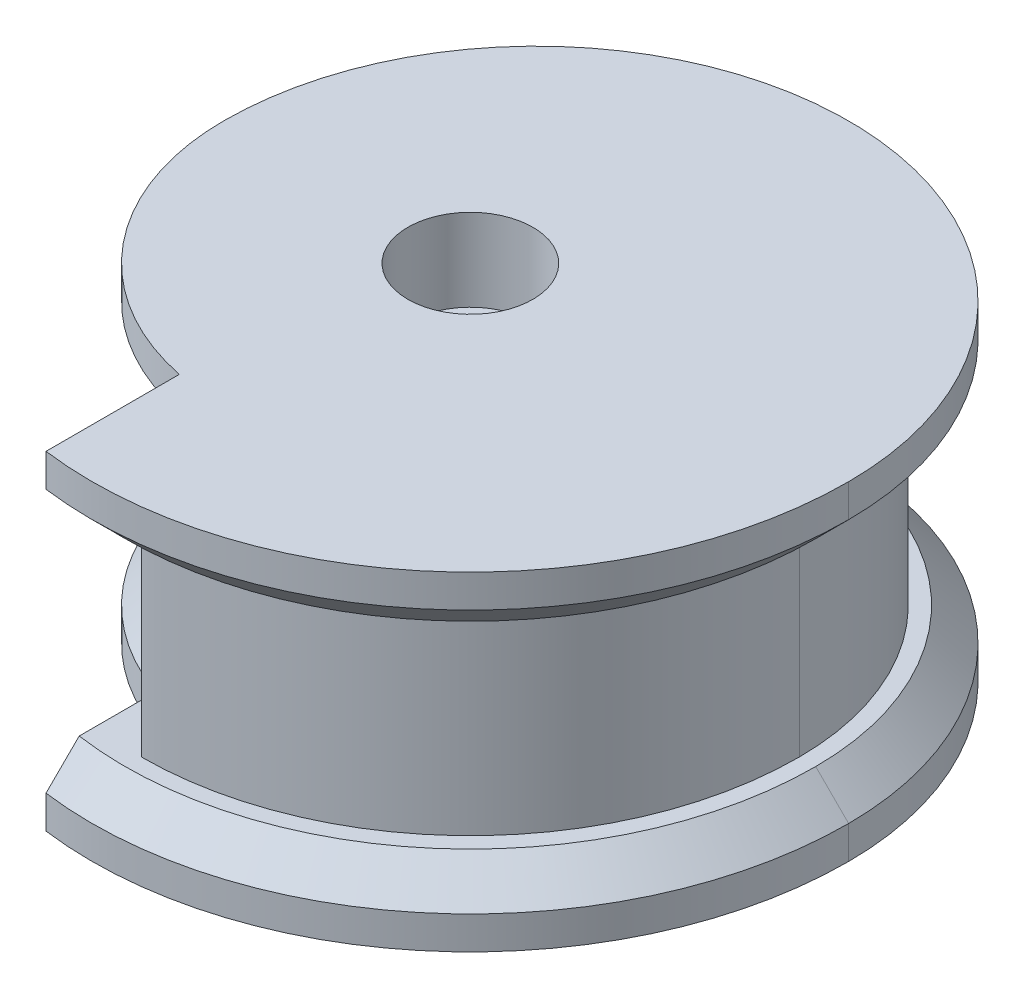
from build123d import *

# Parameters (mm, degrees)
SKETCH1_R           = 6
BOSS_EXTRUDE1_DEPTH = 10
SKETCH2_R           = 1.9
CUT_EXTRUDE1_DEPTH  = 2.5
SKETCH3_R           = 3.75
CUT_EXTRUDE2_DEPTH  = 4.8
BOSS_EXTRUDE2_DEPTH = 10
BOSS_EXTRUDE3_DEPTH = 2
BOSS_EXTRUDE5_START = -2
SKETCH9_R           = 1.9
BOSS_EXTRUDE5_DEPTH = 2
CHAMFER1_SIZE       = 1


with BuildPart() as part:
    # Sketch1 → Boss-Extrude1 (new body)
    with BuildSketch(Plane(origin=(0, 0, 0), x_dir=(1, 0, 0), z_dir=(0, 1, 0))):
        with Locations(Location((0, 0, 0), (0, 0, 270))):
            Circle(SKETCH1_R)
    extrude(amount=BOSS_EXTRUDE1_DEPTH)

    # Sketch2 → Cut-Extrude1 (cut)
    with BuildSketch(Plane(origin=(0, 10, 0), x_dir=(1, 0, 0), z_dir=(0, 1, 0))):
        with Locations(Location((0, 0, 0), (0, 0, 270))):
            Circle(SKETCH2_R)
    extrude(amount=-CUT_EXTRUDE1_DEPTH, mode=Mode.SUBTRACT)

    # Sketch3 → Cut-Extrude2 (cut)
    with BuildSketch(Plane.XZ):
        with Locations(Location((0, 0, 0), (0, 0, 270))):
            Circle(SKETCH3_R)
    extrude(amount=-CUT_EXTRUDE2_DEPTH, mode=Mode.SUBTRACT)

    # Sketch5 → Boss-Extrude2 (add)
    with BuildSketch(Plane.XZ):
        with BuildLine():
            Line((0, 6), (0, 10))
            ThreePointArc((0, 10), (7.071067812, 7.071067812), (10, 0))
            ThreePointArc((10, 0), (2, -8), (-6, 0))
            ThreePointArc((-6, 0), (4.242640687, -4.242640687), (0, 6))
        make_face()
    extrude(amount=-BOSS_EXTRUDE2_DEPTH)

    # Sketch7 → Boss-Extrude3 (add)
    with BuildSketch(Plane.XZ):
        with BuildLine():
            Line((-1.5, 11.401754251), (-1.5, 7.348469228))
            ThreePointArc((-1.5, 7.348469228), (-5.809475019, 4.74341649), (-7.5, 0))
            ThreePointArc((-7.5, 0), (2, -9.5), (11.5, 0))
            ThreePointArc((11.5, 0), (7.582875444, 8.645808233), (-1.5, 11.401754251))
        make_face()
        with BuildLine():
            Line((0, 10), (0, 6))
            ThreePointArc((0, 6), (-4.242640687, 4.242640687), (-6, 0))
            ThreePointArc((-6, 0), (2, -8), (10, 0))
            ThreePointArc((10, 0), (7.071067812, 7.071067812), (0, 10))
        make_face(mode=Mode.SUBTRACT)
    extrude(amount=-BOSS_EXTRUDE3_DEPTH)

    # Sketch9 → Boss-Extrude5 (add)
    with BuildSketch(Plane(origin=(0, 10, 0), x_dir=(1, 0, 0), z_dir=(0, 1, 0)).offset(BOSS_EXTRUDE5_START)):
        with BuildLine():
            Line((-1.5, -11.401754251), (-1.5, -7.348469228))
            ThreePointArc((-1.5, -7.348469228), (-5.809475019, -4.74341649), (-7.5, 0))
            ThreePointArc((-7.5, 0), (2, 9.5), (11.5, 0))
            ThreePointArc((11.5, 0), (7.582875444, -8.645808233), (-1.5, -11.401754251))
        make_face()
        with Locations(Location((0, 0, 0), (0, 0, 270))):
            Circle(SKETCH9_R, mode=Mode.SUBTRACT)
    extrude(amount=BOSS_EXTRUDE5_DEPTH)

    # Chamfer1
    chamfer1_edges = [part.edges().sort_by_distance(p)[0] for p in [
        (7.582875444, 2, 8.645808233),
        (2, 2, -9.5),
        (-5.809475019, 2, 4.74341649),
        (-5.809475019, 8, 4.74341649),
        (2, 8, -9.5),
        (7.582875444, 8, 8.645808233),
    ]]
    chamfer(chamfer1_edges, length=CHAMFER1_SIZE)


solid = part.part
